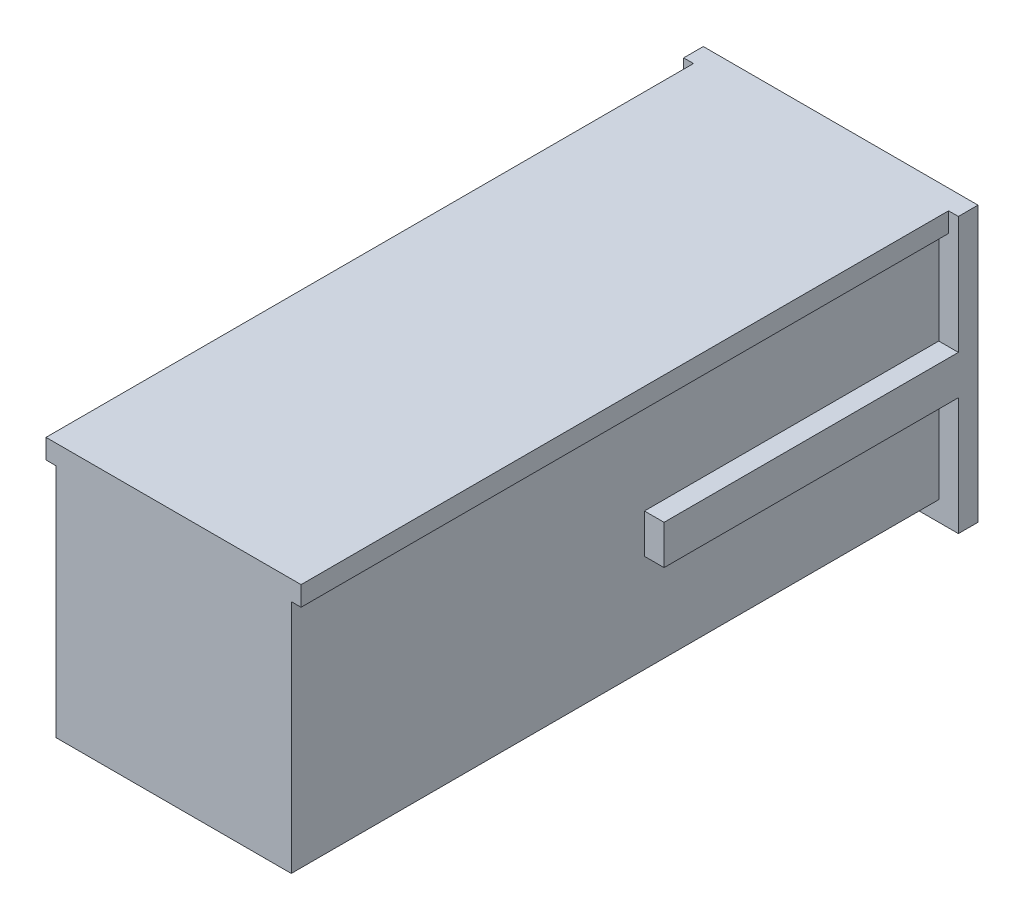
from build123d import *

# Parameters (mm, degrees)
SKETCH_1_W      = 600
SKETCH_1_H      = 600
EXTRUDE_1_DEPTH = 1700
SKETCH_2_W      = 650
SKETCH_2_H      = 50
EXTRUDE_2_DEPTH = 1700
SKETCH_3_W      = 50
SKETCH_3_H      = 100
EXTRUDE_3_DEPTH = 800
SKETCH_4_W      = 700
SKETCH_4_H      = 700
EXTRUDE_4_DEPTH = 50


with BuildPart() as part:
    # 草图1 → 凸台-拉伸1 (new body)
    with BuildSketch(Plane.XY):
        Rectangle(SKETCH_1_W, SKETCH_1_H)
    extrude(amount=EXTRUDE_1_DEPTH)

    # 草图2 → 凸台-拉伸2 (add)
    with BuildSketch(Plane.XY):
        with Locations((0, 325)):
            Rectangle(SKETCH_2_W, SKETCH_2_H)
    extrude(amount=EXTRUDE_2_DEPTH)

    # 草图3 → 凸台-拉伸3 (add)
    with BuildSketch(Plane.XY):
        with Locations((325, 0)):
            Rectangle(SKETCH_3_W, SKETCH_3_H)
    extrude(amount=EXTRUDE_3_DEPTH)

    # 草图4 → 凸台-拉伸4 (add)
    with BuildSketch(Plane.XY):
        Rectangle(SKETCH_4_W, SKETCH_4_H)
    extrude(amount=EXTRUDE_4_DEPTH)


solid = part.part
